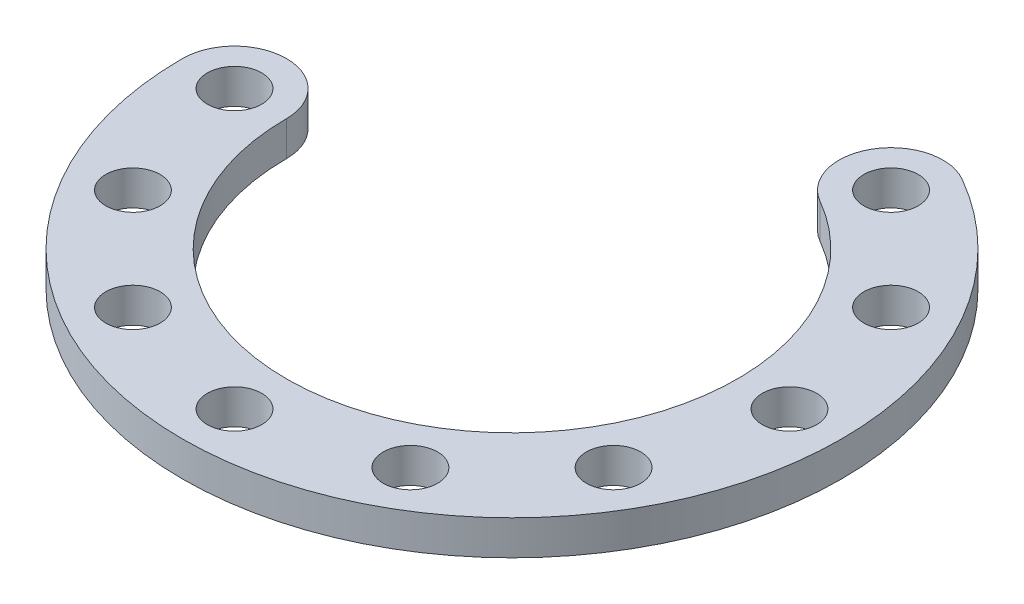
from build123d import *

# Parameters (mm, degrees)
SKETCH1_R           = 2.4892
BOSS_EXTRUDE1_DEPTH = 3.175


with BuildPart() as part:
    # Sketch1 → Boss-Extrude1 (new body)
    with BuildSketch(Plane(origin=(0, 0, 0), x_dir=(1, 0, 0), z_dir=(0, 1, 0))):
        with BuildLine():
            ThreePointArc((-30.1625, 0), (15.08125, -26.121491242), (15.08125, 26.121491242))
            ThreePointArc((15.08125, 26.121491242), (8.575554014, 24.378295256), (10.31875, 17.872599271))
            ThreePointArc((10.31875, 17.872599271), (10.31875, -17.872599271), (-20.6375, 0))
            ThreePointArc((-20.6375, 0), (-25.4, 4.7625), (-30.1625, 0))
        make_face()
        with Locations(Location((25.4, 0, 0), (0, 0, 270))):
            Circle(SKETCH1_R, mode=Mode.SUBTRACT)
        with Locations(Location((21.997045256, -12.7, 0), (0, 0, 270))):
            Circle(SKETCH1_R, mode=Mode.SUBTRACT)
        with Locations(Location((12.7, -21.997045256, 0), (0, 0, 270))):
            Circle(SKETCH1_R, mode=Mode.SUBTRACT)
        with Locations(Location((0, -25.4, 0), (0, 0, 270))):
            Circle(SKETCH1_R, mode=Mode.SUBTRACT)
        with Locations(Location((-12.7, -21.997045256, 0), (0, 0, 270))):
            Circle(SKETCH1_R, mode=Mode.SUBTRACT)
        with Locations(Location((-21.997045256, -12.7, 0), (0, 0, 270))):
            Circle(SKETCH1_R, mode=Mode.SUBTRACT)
        with Locations(Location((-25.4, 0, 0), (0, 0, 270))):
            Circle(SKETCH1_R, mode=Mode.SUBTRACT)
        with Locations(Location((12.7, 21.997045256, 0), (0, 0, 270))):
            Circle(SKETCH1_R, mode=Mode.SUBTRACT)
        with Locations(Location((21.997045256, 12.7, 0), (0, 0, 270))):
            Circle(SKETCH1_R, mode=Mode.SUBTRACT)
    extrude(amount=BOSS_EXTRUDE1_DEPTH)


solid = part.part
